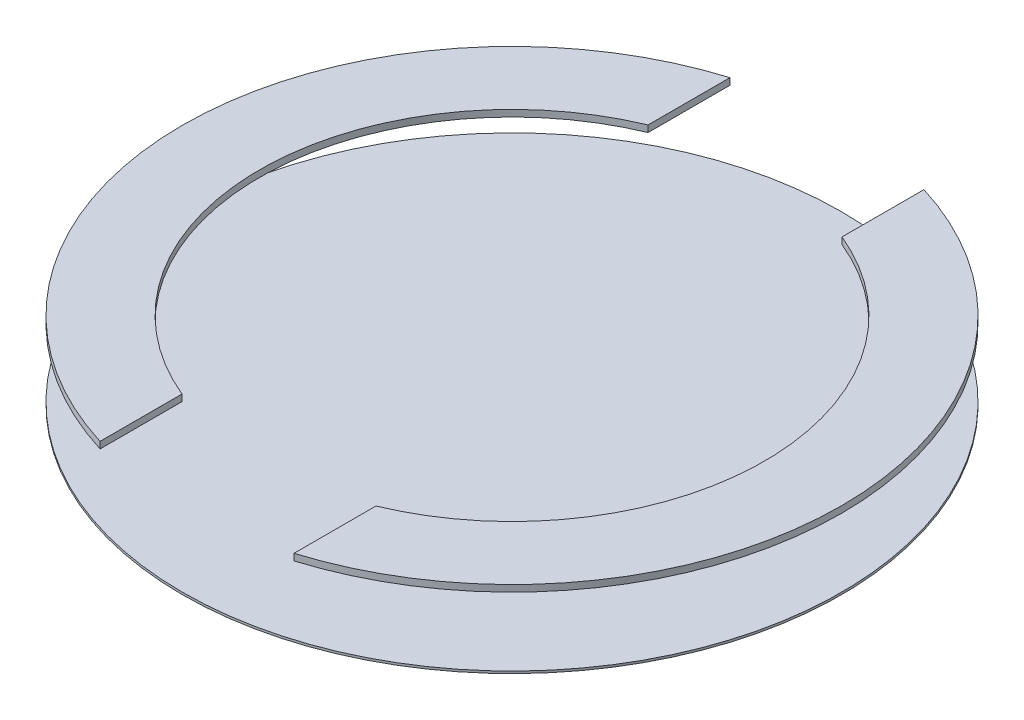
from build123d import *

# Parameters (mm, degrees)
BOSS_EXTRUDE4_DEPTH     = 650
BOSS_EXTRUDE4_2_DEPTH   = 650
BOSS_EXTRUDE5_START     = 10
SKETCH3_R               = 1495.54
BOSS_EXTRUDE5_DEPTH     = 10
CUT_EXTRUDE1_DEPTH      = 2213.640906971
CUT_EXTRUDE1_DEPTH_BACK = 2213.640906971
SKETCH4_W               = 3005.574253275
SKETCH4_H               = 310
CUT_EXTRUDE2_DEPTH      = 2143.167076397
CUT_EXTRUDE2_DEPTH_BACK = 2143.167076397
SKETCH5_W               = 2991.08
SKETCH5_H               = 310


with BuildPart() as part:
    # Sketch1 → Boss-Extrude4 (new body)
    with BuildSketch(Plane(origin=(0, 0, 0), x_dir=(1, 0, 0), z_dir=(0, 1, 0))):
        with BuildLine():
            ThreePointArc((440.10401327, 1057.506475536), (1145.43069991, 0), (440.10401327, -1057.506475536))
            Line((440.10401327, -1057.506475536), (440.10401327, -1429.317441685))
            ThreePointArc((440.10401327, -1429.317441685), (1203.086249528, -888.382444557), (1495.54, 0))
            ThreePointArc((1495.54, 0), (1203.086249528, 888.382444557), (440.10401327, 1429.317441685))
            Line((440.10401327, 1429.317441685), (440.10401327, 1057.506475536))
        make_face()
    extrude(amount=BOSS_EXTRUDE4_DEPTH)



with BuildPart() as body_2:
    # Sketch1 → Boss-Extrude4 2 (new body)
    with BuildSketch(Plane(origin=(0, 0, 0), x_dir=(1, 0, 0), z_dir=(0, 1, 0))):
        with BuildLine():
            ThreePointArc((-440.10401327, 1429.317441685), (-1495.54, 0), (-440.10401327, -1429.317441685))
            Line((-440.10401327, -1429.317441685), (-440.10401327, -1057.506475536))
            ThreePointArc((-440.10401327, -1057.506475536), (-1145.43069991, 0), (-440.10401327, 1057.506475536))
            Line((-440.10401327, 1057.506475536), (-440.10401327, 1429.317441685))
        make_face()
    extrude(amount=BOSS_EXTRUDE4_2_DEPTH)


with BuildPart() as part_1:
    add(part.part)

    add(body_2.part)  # Boss-Extrude5 merges body 2
    # Sketch3 → Boss-Extrude5 (add)
    with BuildSketch(Plane.XZ.offset(BOSS_EXTRUDE5_START)):
        with Locations(Location((0, 0, 0), (0, 0, 270))):
            Circle(SKETCH3_R)
    extrude(amount=-BOSS_EXTRUDE5_DEPTH)

    # Sketch4 → Cut-Extrude1 (cut, two sides: drawn at the far end of the back side and taken through both)
    with BuildSketch(Plane.XY.offset(-CUT_EXTRUDE1_DEPTH_BACK)):
        with Locations((7.247126637, 495)):
            Rectangle(SKETCH4_W, SKETCH4_H)
    extrude(amount=CUT_EXTRUDE1_DEPTH + CUT_EXTRUDE1_DEPTH_BACK, mode=Mode.SUBTRACT)

    # Sketch5 → Cut-Extrude2 (cut, two sides: drawn at the far end of the back side and taken through both)
    with BuildSketch(Plane.XY.offset(-CUT_EXTRUDE2_DEPTH_BACK)):
        with Locations((0, 155)):
            Rectangle(SKETCH5_W, SKETCH5_H)
    extrude(amount=CUT_EXTRUDE2_DEPTH + CUT_EXTRUDE2_DEPTH_BACK, mode=Mode.SUBTRACT)


with BuildPart() as cut_extrude2_piece_1:
    # of the separate pieces the step leaves, piece 1, a body of its own (cut_extrude2_pieces)
    add(part_1.part.solids().sort_by_distance((0, -10, -1495.54))[0])


with BuildPart() as cut_extrude2_piece_2:
    # of the separate pieces the step leaves, piece 2, a body of its own (cut_extrude2_pieces)
    add(part_1.part.solids().sort_by_distance((440.10401327, 310, 1429.317441685))[0])


with BuildPart() as cut_extrude2_piece_3:
    # of the separate pieces the step leaves, piece 3, a body of its own (cut_extrude2_pieces)
    add(part_1.part.solids().sort_by_distance((-440.10401327, 310, -1429.317441685))[0])


solid = Compound([cut_extrude2_piece_1.part, cut_extrude2_piece_2.part, cut_extrude2_piece_3.part])
